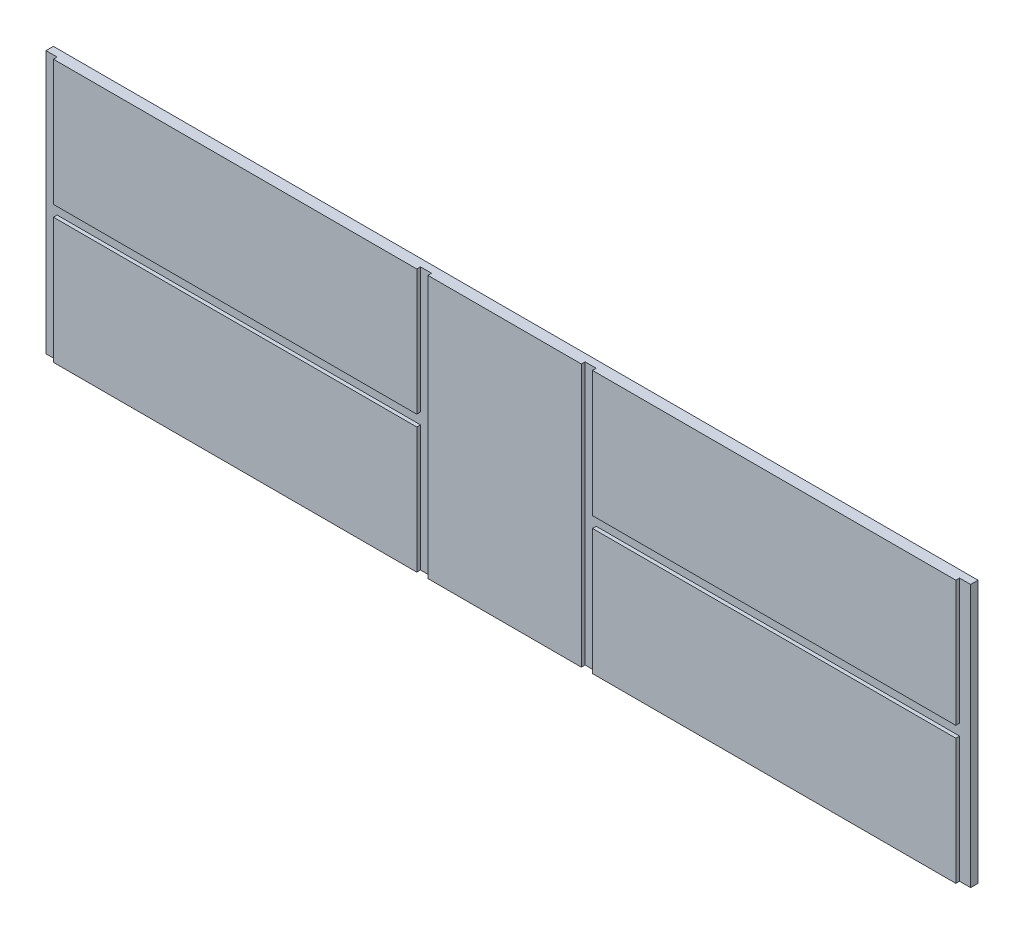
from build123d import *

# Parameters (mm, degrees)
PANEL_W                      = 1000
PANEL_H                      = 284
PANEL_PLY_DEPTH              = 12
SKETCH2_W                    = 12
SKETCH2_H                    = 284
VERTICAL_HOUSING_CUT_DEPTH   = 4
SKETCH3_W                    = 393
SKETCH3_H                    = 12
HORIZONTAL_HOUSING_CUT_DEPTH = 4


with BuildPart() as part:
    # Panel → Panel Ply (new body)
    with BuildSketch(Plane.XY):
        with Locations((500, 142)):
            Rectangle(PANEL_W, PANEL_H)
    extrude(amount=PANEL_PLY_DEPTH)

    # Sketch2 → Vertical Housing Cut (cut)
    with BuildSketch(Plane.XY.offset(12)):
        with Locations((6, 142)):
            Rectangle(SKETCH2_W, SKETCH2_H)
        with Locations((994, 142)):
            Rectangle(SKETCH2_W, SKETCH2_H)
        with Locations((411, 142)):
            Rectangle(SKETCH2_W, SKETCH2_H)
        with Locations((589, 142)):
            Rectangle(SKETCH2_W, SKETCH2_H)
    extrude(amount=-VERTICAL_HOUSING_CUT_DEPTH, mode=Mode.SUBTRACT)

    # Sketch3 → Horizontal Housing Cut (cut)
    with BuildSketch(Plane.XY.offset(12)):
        with Locations((208.5, 142)):
            Rectangle(SKETCH3_W, SKETCH3_H)
        with Locations((791.5, 142)):
            Rectangle(SKETCH3_W, SKETCH3_H)
    extrude(amount=-HORIZONTAL_HOUSING_CUT_DEPTH, mode=Mode.SUBTRACT)


solid = part.part
